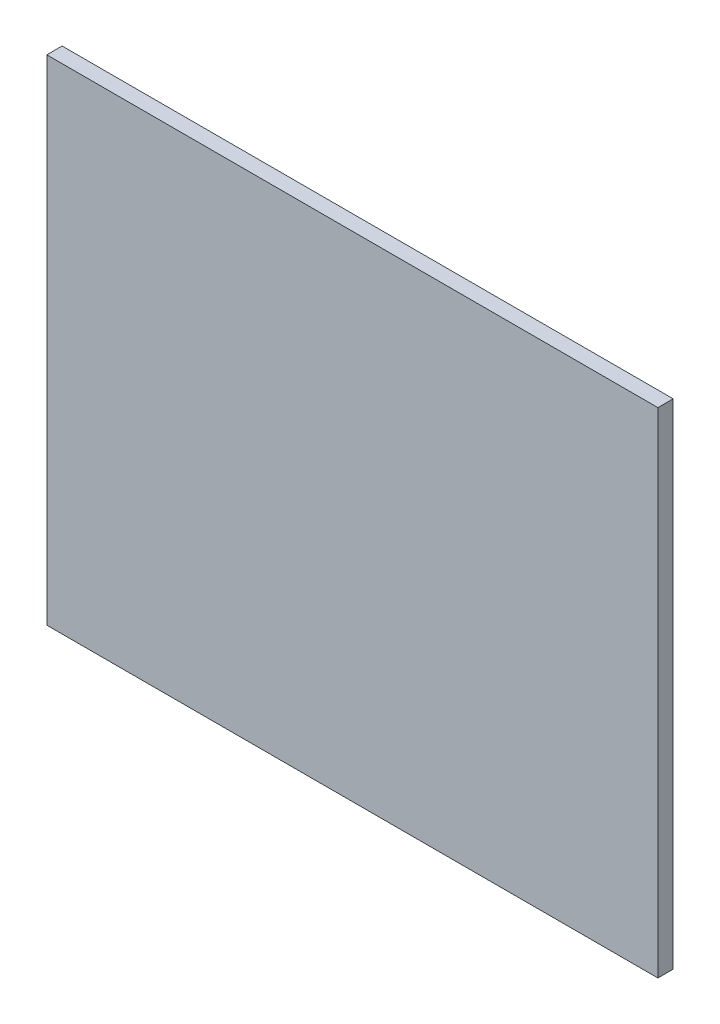
from build123d import *

# Parameters (mm, degrees)
ESBO_O1_W                = 120
ESBO_O1_H                = 97
RESSALTO_EXTRUS_O1_DEPTH = 3


with BuildPart() as part:
    # Esboço1 → Ressalto-extrusão1 (new body)
    with BuildSketch(Plane.XY):
        Rectangle(ESBO_O1_W, ESBO_O1_H)
    extrude(amount=RESSALTO_EXTRUS_O1_DEPTH)


solid = part.part
